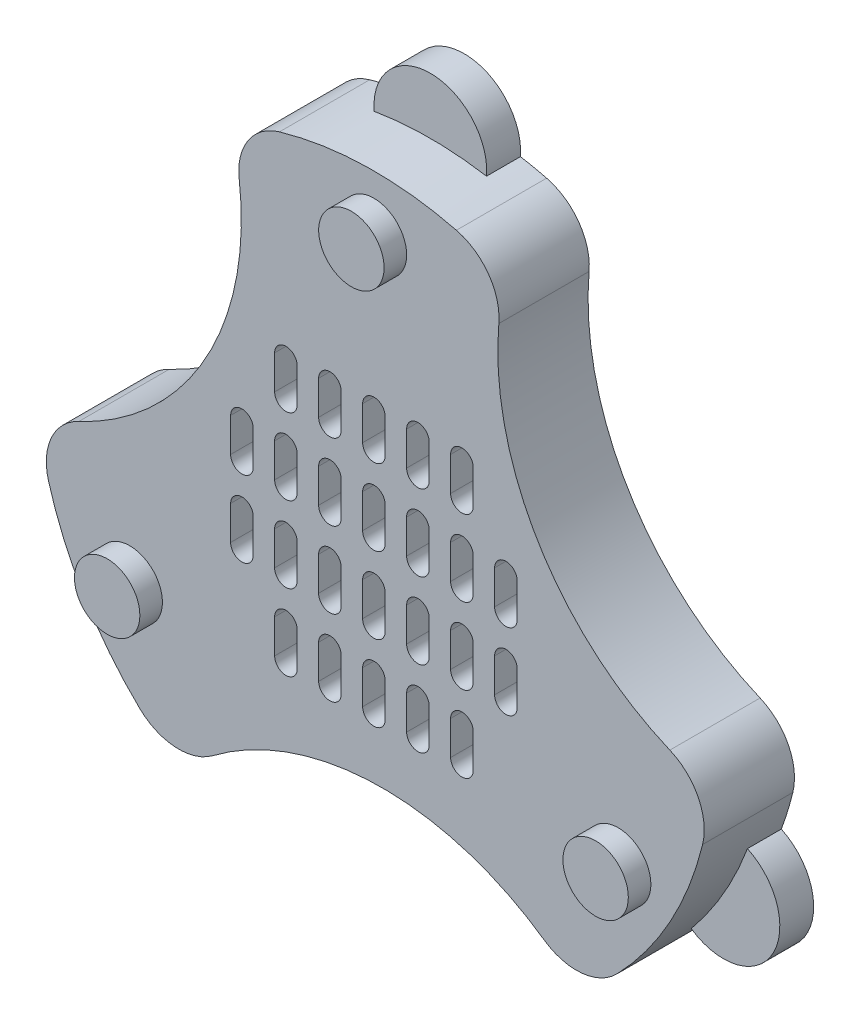
from build123d import *

# Parameters (mm, degrees)
SKETCH2_R           = 18.85
BOSS_EXTRUDE1_DEPTH = 8
SKETCH3_R           = 30
SKETCH3_R_2         = 17.600030795
BOSS_EXTRUDE2_DEPTH = 8
SKETCH4_R           = 2.9
BOSS_EXTRUDE3_DEPTH = 2
SKETCH6_R           = 5
BOSS_EXTRUDE4_DEPTH = 3
SKETCH5_R           = 3
CUT_EXTRUDE1_DEPTH  = 3
SKETCH7_R           = 25
CUT_EXTRUDE2_DEPTH  = 8
FILLET1_R           = 5


with BuildPart() as part:
    # Sketch2 → Boss-Extrude1 (new body)
    with BuildSketch(Plane.XY.offset(10)):
        Circle(SKETCH2_R)
        with BuildLine():
            Line((-6.800750564, 11.632097199), (-6.80194974, 8.632097439))
            ThreePointArc((-6.80194974, 8.632097439), (-7.802349385, 7.632497244), (-8.80194958, 8.632896889))
            Line((-8.80194958, 8.632896889), (-8.800750404, 11.63289665))
            ThreePointArc((-8.800750404, 11.63289665), (-7.800350759, 12.632496845), (-6.800750564, 11.632097199))
        make_face(mode=Mode.SUBTRACT)
        with BuildLine():
            Line((-4.900750404, 11.63289665), (-4.90194958, 8.632896889))
            ThreePointArc((-4.90194958, 8.632896889), (-3.902349385, 7.632497244), (-2.90194974, 8.632097439))
            Line((-2.90194974, 8.632097439), (-2.900750564, 11.632097199))
            ThreePointArc((-2.900750564, 11.632097199), (-3.900350759, 12.632496845), (-4.900750404, 11.63289665))
        make_face(mode=Mode.SUBTRACT)
        with BuildLine():
            Line((-1.000750404, 11.63289665), (-1.00194958, 8.632896889))
            ThreePointArc((-1.00194958, 8.632896889), (-0.002349385, 7.632497244), (0.99805026, 8.632097439))
            Line((0.99805026, 8.632097439), (0.999249436, 11.632097199))
            ThreePointArc((0.999249436, 11.632097199), (-0.000350759, 12.632496845), (-1.000750404, 11.63289665))
        make_face(mode=Mode.SUBTRACT)
        with BuildLine():
            Line((2.899249596, 11.63289665), (2.89805042, 8.632896889))
            ThreePointArc((2.89805042, 8.632896889), (3.897650615, 7.632497244), (4.89805026, 8.632097439))
            Line((4.89805026, 8.632097439), (4.899249436, 11.632097199))
            ThreePointArc((4.899249436, 11.632097199), (3.899649241, 12.632496845), (2.899249596, 11.63289665))
        make_face(mode=Mode.SUBTRACT)
        with BuildLine():
            Line((6.799249596, 11.63289665), (6.79805042, 8.632896889))
            ThreePointArc((6.79805042, 8.632896889), (7.797650615, 7.632497244), (8.79805026, 8.632097439))
            Line((8.79805026, 8.632097439), (8.799249436, 11.632097199))
            ThreePointArc((8.799249436, 11.632097199), (7.799649241, 12.632496845), (6.799249596, 11.63289665))
        make_face(mode=Mode.SUBTRACT)
        with BuildLine():
            Line((-10.703450753, 1.876998531), (-10.7019502, 4.876998531))
            ThreePointArc((-10.7019502, 4.876998531), (-11.701449891, 5.87749859), (-12.70194995, 4.877998899))
            Line((-12.70194995, 4.877998899), (-12.703450502, 1.877998899))
            ThreePointArc((-12.703450502, 1.877998899), (-11.703950811, 0.87749884), (-10.703450753, 1.876998531))
        make_face(mode=Mode.SUBTRACT)
        with BuildLine():
            Line((-8.803450087, 1.877998899), (-8.801949535, 4.877998899))
            ThreePointArc((-8.801949535, 4.877998899), (-7.801449476, 5.87749859), (-6.801949785, 4.876998531))
            Line((-6.801949785, 4.876998531), (-6.803450337, 1.876998531))
            ThreePointArc((-6.803450337, 1.876998531), (-7.803950396, 0.87749884), (-8.803450087, 1.877998899))
        make_face(mode=Mode.SUBTRACT)
        with BuildLine():
            Line((-2.903450337, 1.876998531), (-2.901949785, 4.876998531))
            ThreePointArc((-2.901949785, 4.876998531), (-3.901449476, 5.87749859), (-4.901949535, 4.877998899))
            Line((-4.901949535, 4.877998899), (-4.903450087, 1.877998899))
            ThreePointArc((-4.903450087, 1.877998899), (-3.903950396, 0.87749884), (-2.903450337, 1.876998531))
        make_face(mode=Mode.SUBTRACT)
        with BuildLine():
            Line((0.996549663, 1.876998531), (0.998050215, 4.876998531))
            ThreePointArc((0.998050215, 4.876998531), (-0.001449476, 5.87749859), (-1.001949535, 4.877998899))
            Line((-1.001949535, 4.877998899), (-1.003450087, 1.877998899))
            ThreePointArc((-1.003450087, 1.877998899), (-0.003950396, 0.87749884), (0.996549663, 1.876998531))
        make_face(mode=Mode.SUBTRACT)
        with BuildLine():
            Line((4.896549663, 1.876998531), (4.898050215, 4.876998531))
            ThreePointArc((4.898050215, 4.876998531), (3.898550524, 5.87749859), (2.898050465, 4.877998899))
            Line((2.898050465, 4.877998899), (2.896549913, 1.877998899))
            ThreePointArc((2.896549913, 1.877998899), (3.896049604, 0.87749884), (4.896549663, 1.876998531))
        make_face(mode=Mode.SUBTRACT)
        with BuildLine():
            Line((8.796549663, 1.876998531), (8.798050215, 4.876998531))
            ThreePointArc((8.798050215, 4.876998531), (7.798550524, 5.87749859), (6.798050465, 4.877998899))
            Line((6.798050465, 4.877998899), (6.796549913, 1.877998899))
            ThreePointArc((6.796549913, 1.877998899), (7.796049604, 0.87749884), (8.796549663, 1.876998531))
        make_face(mode=Mode.SUBTRACT)
        with BuildLine():
            Line((12.696549663, 1.876998531), (12.698050215, 4.876998531))
            ThreePointArc((12.698050215, 4.876998531), (11.698550524, 5.87749859), (10.698050465, 4.877998899))
            Line((10.698050465, 4.877998899), (10.696549913, 1.877998899))
            ThreePointArc((10.696549913, 1.877998899), (11.696049604, 0.87749884), (12.696549663, 1.876998531))
        make_face(mode=Mode.SUBTRACT)
        with BuildLine():
            Line((-8.804648151, -4.877758991), (-8.800750032, -1.877758991))
            ThreePointArc((-8.800750032, -1.877758991), (-7.799451504, -0.879059207), (-6.80075172, -1.880357735))
            Line((-6.80075172, -1.880357735), (-6.80464984, -4.880357735))
            ThreePointArc((-6.80464984, -4.880357735), (-7.805948368, -5.879057519), (-8.804648151, -4.877758991))
        make_face(mode=Mode.SUBTRACT)
        with BuildLine():
            Line((-2.90464984, -4.880357735), (-2.90075172, -1.880357735))
            ThreePointArc((-2.90075172, -1.880357735), (-3.899451504, -0.879059207), (-4.900750032, -1.877758991))
            Line((-4.900750032, -1.877758991), (-4.904648151, -4.877758991))
            ThreePointArc((-4.904648151, -4.877758991), (-3.905948368, -5.879057519), (-2.90464984, -4.880357735))
        make_face(mode=Mode.SUBTRACT)
        with BuildLine():
            Line((0.99535016, -4.880357735), (0.99924828, -1.880357735))
            ThreePointArc((0.99924828, -1.880357735), (0.000548496, -0.879059207), (-1.000750032, -1.877758991))
            Line((-1.000750032, -1.877758991), (-1.004648151, -4.877758991))
            ThreePointArc((-1.004648151, -4.877758991), (-0.005948368, -5.879057519), (0.99535016, -4.880357735))
        make_face(mode=Mode.SUBTRACT)
        with BuildLine():
            Line((4.89535016, -4.880357735), (4.89924828, -1.880357735))
            ThreePointArc((4.89924828, -1.880357735), (3.900548496, -0.879059207), (2.899249968, -1.877758991))
            Line((2.899249968, -1.877758991), (2.895351849, -4.877758991))
            ThreePointArc((2.895351849, -4.877758991), (3.894051632, -5.879057519), (4.89535016, -4.880357735))
        make_face(mode=Mode.SUBTRACT)
        with BuildLine():
            Line((8.79535016, -4.880357735), (8.79924828, -1.880357735))
            ThreePointArc((8.79924828, -1.880357735), (7.800548496, -0.879059207), (6.799249968, -1.877758991))
            Line((6.799249968, -1.877758991), (6.795351849, -4.877758991))
            ThreePointArc((6.795351849, -4.877758991), (7.794051632, -5.879057519), (8.79535016, -4.880357735))
        make_face(mode=Mode.SUBTRACT)
        with BuildLine():
            Line((12.69535016, -4.880357735), (12.69924828, -1.880357735))
            ThreePointArc((12.69924828, -1.880357735), (11.700548496, -0.879059207), (10.699249968, -1.877758991))
            Line((10.699249968, -1.877758991), (10.695351849, -4.877758991))
            ThreePointArc((10.695351849, -4.877758991), (11.694051632, -5.879057519), (12.69535016, -4.880357735))
        make_face(mode=Mode.SUBTRACT)
        with BuildLine():
            Line((-10.70464984, -4.880357735), (-10.70075172, -1.880357735))
            ThreePointArc((-10.70075172, -1.880357735), (-11.699451504, -0.879059207), (-12.700750032, -1.877758991))
            Line((-12.700750032, -1.877758991), (-12.704648151, -4.877758991))
            ThreePointArc((-12.704648151, -4.877758991), (-11.705948368, -5.879057519), (-10.70464984, -4.880357735))
        make_face(mode=Mode.SUBTRACT)
        with BuildLine():
            Line((-6.800749353, -8.635615621), (-6.800749353, -11.635615621))
            ThreePointArc((-6.800749353, -11.635615621), (-7.800749353, -12.635615621), (-8.800749353, -11.635615621))
            Line((-8.800749353, -11.635615621), (-8.800749353, -8.635615621))
            ThreePointArc((-8.800749353, -8.635615621), (-7.800749353, -7.635615621), (-6.800749353, -8.635615621))
        make_face(mode=Mode.SUBTRACT)
        with BuildLine():
            Line((-4.900749353, -8.635615621), (-4.900749353, -11.635615621))
            ThreePointArc((-4.900749353, -11.635615621), (-3.900749353, -12.635615621), (-2.900749353, -11.635615621))
            Line((-2.900749353, -11.635615621), (-2.900749353, -8.635615621))
            ThreePointArc((-2.900749353, -8.635615621), (-3.900749353, -7.635615621), (-4.900749353, -8.635615621))
        make_face(mode=Mode.SUBTRACT)
        with BuildLine():
            Line((-1.000749353, -8.635615621), (-1.000749353, -11.635615621))
            ThreePointArc((-1.000749353, -11.635615621), (-0.000749353, -12.635615621), (0.999250647, -11.635615621))
            Line((0.999250647, -11.635615621), (0.999250647, -8.635615621))
            ThreePointArc((0.999250647, -8.635615621), (-0.000749353, -7.635615621), (-1.000749353, -8.635615621))
        make_face(mode=Mode.SUBTRACT)
        with BuildLine():
            Line((2.899250647, -8.635615621), (2.899250647, -11.635615621))
            ThreePointArc((2.899250647, -11.635615621), (3.899250647, -12.635615621), (4.899250647, -11.635615621))
            Line((4.899250647, -11.635615621), (4.899250647, -8.635615621))
            ThreePointArc((4.899250647, -8.635615621), (3.899250647, -7.635615621), (2.899250647, -8.635615621))
        make_face(mode=Mode.SUBTRACT)
        with BuildLine():
            Line((6.799250647, -8.635615621), (6.799250647, -11.635615621))
            ThreePointArc((6.799250647, -11.635615621), (7.799250647, -12.635615621), (8.799250647, -11.635615621))
            Line((8.799250647, -11.635615621), (8.799250647, -8.635615621))
            ThreePointArc((8.799250647, -8.635615621), (7.799250647, -7.635615621), (6.799250647, -8.635615621))
        make_face(mode=Mode.SUBTRACT)
    extrude(amount=BOSS_EXTRUDE1_DEPTH)

    # Sketch3 → Boss-Extrude2 (add)
    with BuildSketch(Plane.XY.offset(18)):
        Circle(SKETCH3_R)
        Circle(SKETCH3_R_2, mode=Mode.SUBTRACT)
    extrude(amount=-BOSS_EXTRUDE2_DEPTH)

    # Sketch4 → Boss-Extrude3 (add)
    with BuildSketch(Plane.XY.offset(18)):
        with Locations((0, 25)):
            Circle(SKETCH4_R)
        with Locations((21.650635095, -12.5)):
            Circle(SKETCH4_R)
        with Locations((-21.650635095, -12.5)):
            Circle(SKETCH4_R)
    extrude(amount=BOSS_EXTRUDE3_DEPTH)

    # Sketch6 → Boss-Extrude4 (add)
    with BuildSketch(Plane(origin=(0, 0, 10), x_dir=(-1, 0, 0), z_dir=(0, 0, -1))):
        with Locations((0, 30)):
            Circle(SKETCH6_R)
        with Locations((25.980762114, -15)):
            Circle(SKETCH6_R)
        with Locations((-25.980762114, -15)):
            Circle(SKETCH6_R)
    extrude(amount=-BOSS_EXTRUDE4_DEPTH)

    # Sketch5 → Cut-Extrude1 (cut)
    with BuildSketch(Plane(origin=(0, 0, 10), x_dir=(-1, 0, 0), z_dir=(0, 0, -1))):
        with Locations((0, 25)):
            Circle(SKETCH5_R)
        with Locations((21.650635095, -12.5)):
            Circle(SKETCH5_R)
        with Locations((-21.650635095, -12.5)):
            Circle(SKETCH5_R)
    extrude(amount=-CUT_EXTRUDE1_DEPTH, mode=Mode.SUBTRACT)

    # Sketch7 → Cut-Extrude2 (cut)
    with BuildSketch(Plane(origin=(0, 0, 10), x_dir=(-1, 0, 0), z_dir=(0, 0, -1))):
        with Locations((-35.980083702, 21.666415873)):
            Circle(SKETCH7_R)
        with Locations((36.753708406, 20.32645858)):
            Circle(SKETCH7_R)
        with Locations((-0.773624703, -41.992874453)):
            Circle(SKETCH7_R)
    extrude(amount=-CUT_EXTRUDE2_DEPTH, mode=Mode.SUBTRACT)

    # Fillet1
    fillet1_edges = [part.edges().sort_by_distance(p)[0] for p in [
        (29.888839754, -2.580166302, 14),
        (11.700383981, 27.624283062, 14),
        (-12.709930313, 27.174577668, 14),
        (-29.773522884, -3.679311769, 14),
        (-17.178909441, -24.594411366, 14),
        (18.073138902, -23.944971293, 14),
    ]]
    fillet(fillet1_edges, radius=FILLET1_R)


solid = part.part
